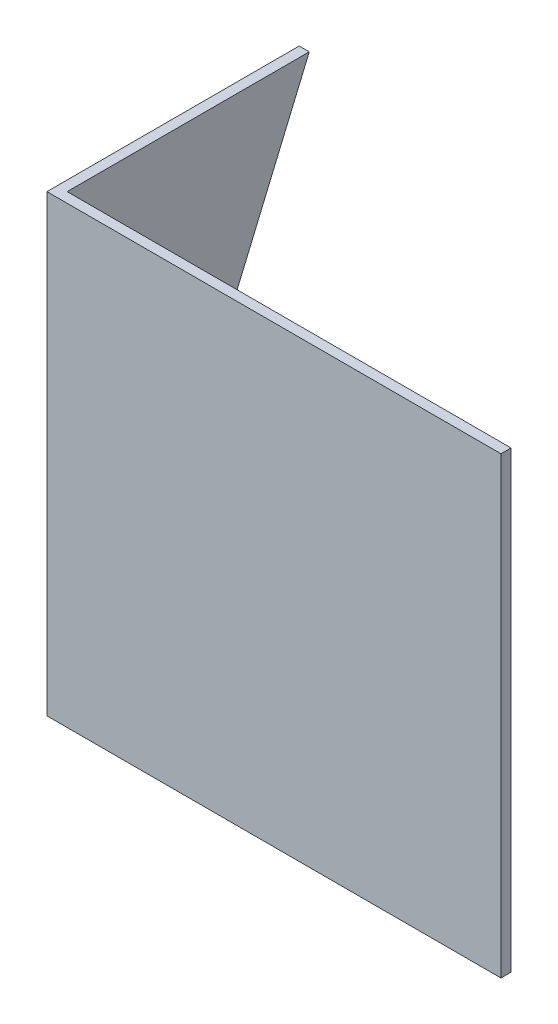
from build123d import *

# Parameters (mm, degrees)
SKETCH1_W           = 2
SKETCH1_H           = 48
SKETCH1_H_2         = 2
SKETCH1_W_2         = 88
BOSS_EXTRUDE1_DEPTH = 90
CUT_EXTRUDE1_REACH  = 133.53


with BuildPart() as part:
    # Sketch1 → Boss-Extrude1 (new body)
    with BuildSketch(Plane(origin=(0, 0, 0), x_dir=(1, 0, 0), z_dir=(0, 1, 0))):
        with Locations((-17.403694266, 9.167350329)):
            Rectangle(SKETCH1_W, SKETCH1_H)
        with Locations((-17.403694266, -15.832649671)):
            Rectangle(SKETCH1_W, SKETCH1_H_2)
        with Locations((27.596305734, -15.832649671)):
            Rectangle(SKETCH1_W_2, SKETCH1_H_2)
    extrude(amount=BOSS_EXTRUDE1_DEPTH)

    # Sketch2 → Cut-Extrude1 (cut, up to next)
    with BuildSketch(Plane.ZY.offset(18.403694266), mode=Mode.PRIVATE) as cut_extrude1_sk1:
        Polygon((-33.167350329, 90), (5.03538313, 0), (-33.167350329, 0), align=None)
    cut_extrude1_tool1 = extrude(cut_extrude1_sk1.sketch, amount=-CUT_EXTRUDE1_REACH, mode=Mode.PRIVATE) & part.part
    add(cut_extrude1_tool1.solids().sort_by_distance((-18.403694, 30, -20.433106))[0], mode=Mode.SUBTRACT)


solid = part.part
